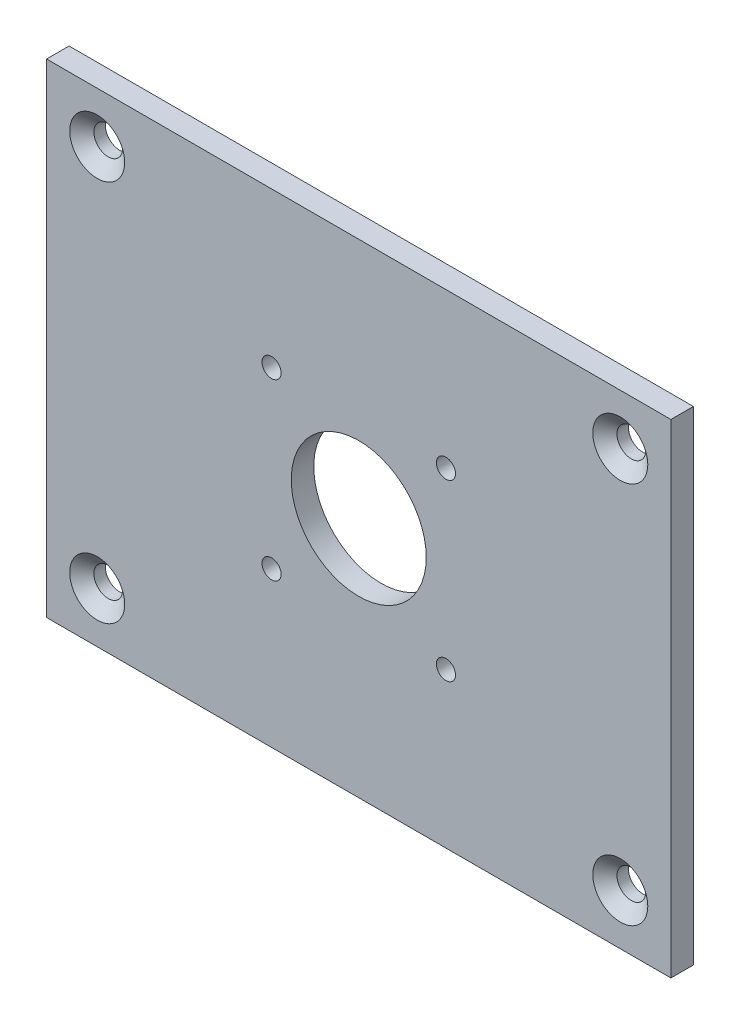
from build123d import *

# Parameters (mm, degrees)
SKETCH1_W                          = 111
SKETCH1_H                          = 86
BASE_DEPTH                         = 4
NEMA_17_SCREW_HOLE_PATTERN_D       = 3.4
SKETCH5_R                          = 12
MOTOR_SHAFT_BOSS_CLEAREANCE_DEPTH  = 141.474196919
WOOD_SCREW_HOLE_PATTERN_AT_2_COUNT = 2
WOOD_SCREW_HOLE_PATTERN_AT_2_PITCH = 115.20850663
WOOD_SCREW_HOLE_PATTERN_AT_3_COUNT = 2
WOOD_SCREW_HOLE_PATTERN_AT_3_PITCH = 68
WOOD_SCREW_HOLE_PATTERN_AT_4_COUNT = 2
WOOD_SCREW_HOLE_PATTERN_AT_4_PITCH = 93


with BuildPart() as part:
    # Sketch1 → base (new body)
    with BuildSketch(Plane.XY):
        with Locations((55.5, 43)):
            Rectangle(SKETCH1_W, SKETCH1_H)
    extrude(amount=BASE_DEPTH)

    # nema 17 screw hole pattern (through all)
    with Locations(Plane.XY.offset(4)):
        with Locations((40, 58.5), (71, 27.5), (40, 27.5), (71, 58.5)):
            Hole(NEMA_17_SCREW_HOLE_PATTERN_D / 2)

    # Sketch5 → motor shaft boss cleareance (cut, through all)
    with BuildSketch(Plane.XY.offset(4)):
        with Locations((55.5, 43)):
            Circle(SKETCH5_R)
    extrude(amount=-MOTOR_SHAFT_BOSS_CLEAREANCE_DEPTH, mode=Mode.SUBTRACT)

    # Sketch7 → wood screw hole pattern (revolve, cut)
    with BuildSketch(Plane(origin=(9, 77, 4), x_dir=(0, -1, 0), z_dir=(1, 0, 0))):
        Polygon((0, 0), (0, 4), (2.5527, 4), (2.5527, 1.960808018), (4.8895, 0), align=None)
    wood_screw_hole_pattern = revolve(axis=Axis((9, 77, 10.35), (0, 0, -1)), mode=Mode.SUBTRACT)

    # wood screw hole pattern at 2: wood screw hole pattern ×2
    with Locations(*[Vector(0.8072320588129593, -0.5902341935406581, 0) * (i * WOOD_SCREW_HOLE_PATTERN_AT_2_PITCH) for i in range(1, WOOD_SCREW_HOLE_PATTERN_AT_2_COUNT)]):
        add(wood_screw_hole_pattern, mode=Mode.SUBTRACT)

    # wood screw hole pattern at 3: wood screw hole pattern ×2
    with Locations(*[(0, -i * WOOD_SCREW_HOLE_PATTERN_AT_3_PITCH, 0) for i in range(1, WOOD_SCREW_HOLE_PATTERN_AT_3_COUNT)]):
        add(wood_screw_hole_pattern, mode=Mode.SUBTRACT)

    # wood screw hole pattern at 4: wood screw hole pattern ×2
    with Locations(*[(i * WOOD_SCREW_HOLE_PATTERN_AT_4_PITCH, 0, 0) for i in range(1, WOOD_SCREW_HOLE_PATTERN_AT_4_COUNT)]):
        add(wood_screw_hole_pattern, mode=Mode.SUBTRACT)


solid = part.part
